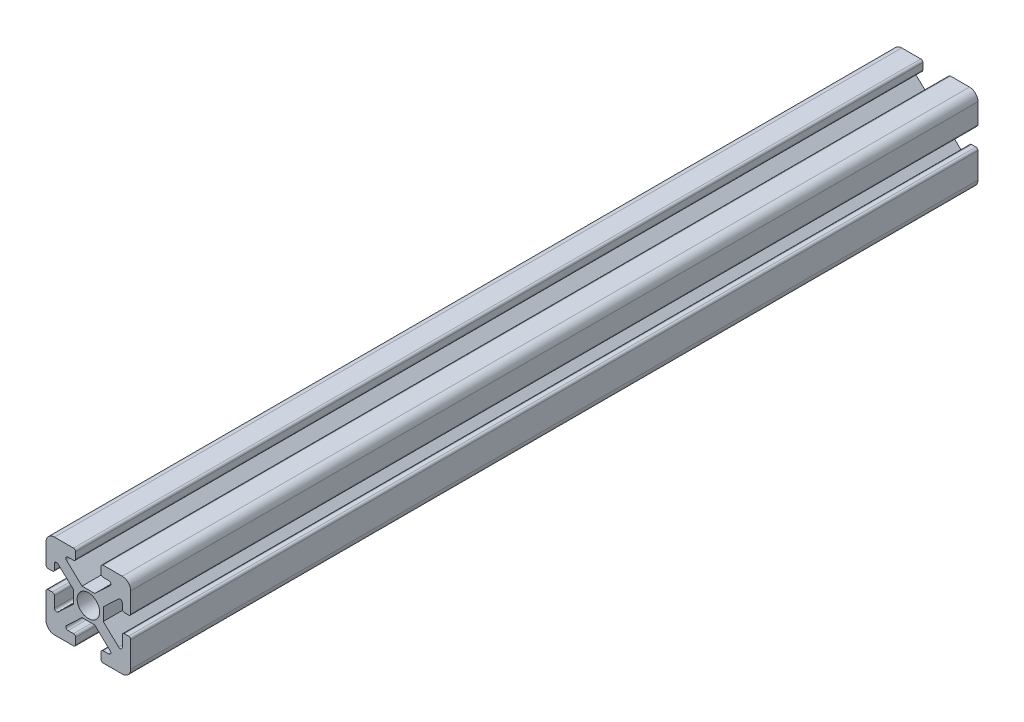
from build123d import *

# Parameters (mm, degrees)
SKETCH2_R           = 2.65
BOSS_EXTRUDE1_DEPTH = 200


with BuildPart() as part:
    # Sketch2 → Boss-Extrude1 (new body)
    with BuildSketch(Plane.XY):
        with BuildLine():
            Line((0, 2), (0, 8.007512652))
            ThreePointArc((0, 8.007512652), (0.146446609, 8.361066043), (0.5, 8.507512652))
            Line((0.5, 8.507512652), (1.5, 8.507512652))
            ThreePointArc((1.5, 8.507512652), (1.853553391, 8.361066043), (2, 8.007512652))
            Line((2, 8.007512652), (2, 5.451323229))
            ThreePointArc((2, 5.451323229), (2.301581692, 4.992378598), (2.842520699, 5.087071159))
            Line((2.842520699, 5.087071159), (6.485041399, 8.512278154))
            Line((6.485041399, 8.512278154), (6.485041399, 11.512278154))
            Line((6.485041399, 11.512278154), (2.842520699, 14.937485148))
            ThreePointArc((2.842520699, 14.937485148), (2.301581692, 15.03217771), (2, 14.573233078))
            Line((2, 14.573233078), (2, 13.307512652))
            ThreePointArc((2, 13.307512652), (1.853553391, 12.953959262), (1.5, 12.807512652))
            Line((1.5, 12.807512652), (0.5, 12.807512652))
            ThreePointArc((0.5, 12.807512652), (0.146446609, 12.953959262), (0, 13.307512652))
            Line((0, 13.307512652), (0, 18))
            ThreePointArc((0, 18), (0.585786438, 19.414213562), (2, 20))
            Line((2, 20), (6.5, 20))
            ThreePointArc((6.5, 20), (6.853553391, 19.853553391), (7, 19.5))
            Line((7, 19.5), (7, 18.017502122))
            ThreePointArc((7, 18.017502122), (6.853553391, 17.663948732), (6.5, 17.517502122))
            Line((6.5, 17.517502122), (5.2, 17.517502122))
            ThreePointArc((5.2, 17.517502122), (4.735174207, 17.201722052), (4.857479301, 16.653250052))
            Line((4.857479301, 16.653250052), (8.5, 13.228043058))
            Line((8.5, 13.228043058), (11.5, 13.228043058))
            Line((11.5, 13.228043058), (15.142520699, 16.653250052))
            ThreePointArc((15.142520699, 16.653250052), (15.264825793, 17.201722052), (14.8, 17.517502122))
            Line((14.8, 17.517502122), (13.5, 17.517502122))
            ThreePointArc((13.5, 17.517502122), (13.146446609, 17.663948732), (13, 18.017502122))
            Line((13, 18.017502122), (13, 19.5))
            ThreePointArc((13, 19.5), (13.146446609, 19.853553391), (13.5, 20))
            Line((13.5, 20), (18, 20))
            ThreePointArc((18, 20), (19.414213562, 19.414213562), (20, 18))
            Line((20, 18), (20, 13.307512652))
            ThreePointArc((20, 13.307512652), (19.853553391, 12.953959262), (19.5, 12.807512652))
            Line((19.5, 12.807512652), (18.5, 12.807512652))
            ThreePointArc((18.5, 12.807512652), (18.146446609, 12.953959262), (18, 13.307512652))
            Line((18, 13.307512652), (18, 14.573233078))
            ThreePointArc((18, 14.573233078), (17.698418308, 15.03217771), (17.157479301, 14.937485148))
            Line((17.157479301, 14.937485148), (13.514958601, 11.512278154))
            Line((13.514958601, 11.512278154), (13.514958601, 8.512278154))
            Line((13.514958601, 8.512278154), (17.157479301, 5.087071159))
            ThreePointArc((17.157479301, 5.087071159), (17.698418308, 4.992378598), (18, 5.451323229))
            Line((18, 5.451323229), (18, 8.007512652))
            ThreePointArc((18, 8.007512652), (18.146446609, 8.361066043), (18.5, 8.507512652))
            Line((18.5, 8.507512652), (19.5, 8.507512652))
            ThreePointArc((19.5, 8.507512652), (19.853553391, 8.361066043), (20, 8.007512652))
            Line((20, 8.007512652), (20, 2))
            ThreePointArc((20, 2), (19.414213562, 0.585786438), (18, 0))
            Line((18, 0), (13.5, 0))
            ThreePointArc((13.5, 0), (13.146446609, 0.146446609), (13, 0.5))
            Line((13, 0.5), (13, 2.007054185))
            ThreePointArc((13, 2.007054185), (13.146446609, 2.360607576), (13.5, 2.507054185))
            Line((13.5, 2.507054185), (14.8, 2.507054185))
            ThreePointArc((14.8, 2.507054185), (15.264825793, 2.822834256), (15.142520699, 3.371306255))
            Line((15.142520699, 3.371306255), (11.5, 6.79651325))
            Line((11.5, 6.79651325), (8.5, 6.79651325))
            Line((8.5, 6.79651325), (4.857479301, 3.371306255))
            ThreePointArc((4.857479301, 3.371306255), (4.735174207, 2.822834256), (5.2, 2.507054185))
            Line((5.2, 2.507054185), (6.5, 2.507054185))
            ThreePointArc((6.5, 2.507054185), (6.853553391, 2.360607576), (7, 2.007054185))
            Line((7, 2.007054185), (7, 0.5))
            ThreePointArc((7, 0.5), (6.853553391, 0.146446609), (6.5, 0))
            Line((6.5, 0), (2, 0))
            ThreePointArc((2, 0), (0.585786438, 0.585786438), (0, 2))
        make_face()
        with Locations((10, 10)):
            Circle(SKETCH2_R, mode=Mode.SUBTRACT)
    extrude(amount=BOSS_EXTRUDE1_DEPTH)


solid = part.part
